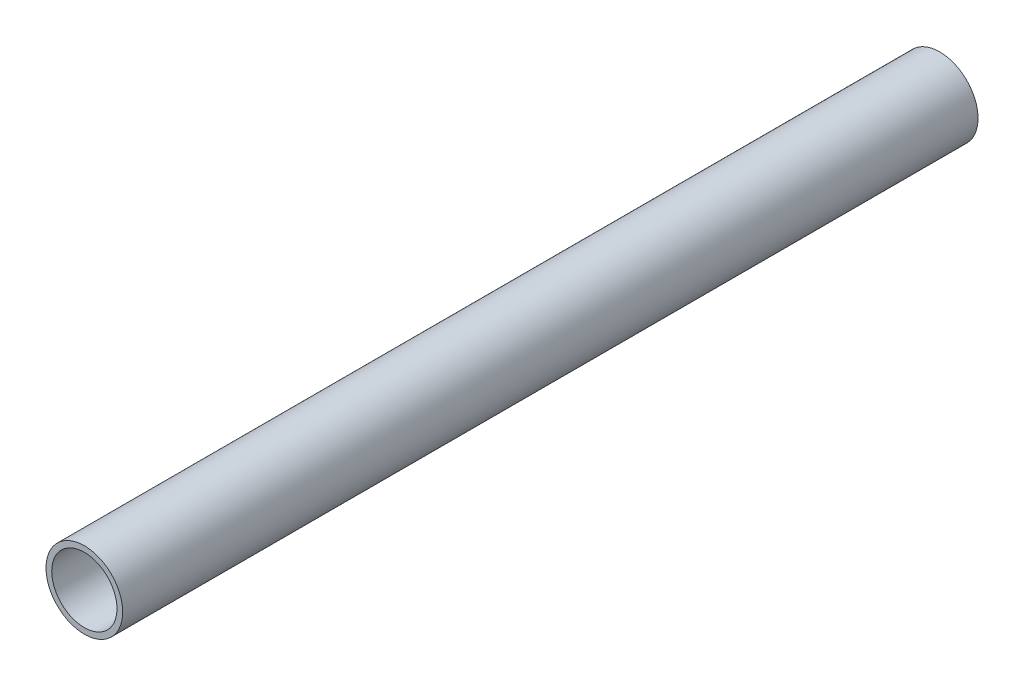
from build123d import *

# Parameters (mm, degrees)
SKETCH1_R           = 13.45
SKETCH1_R_2         = 11.45
EXTRUDE_THIN1_DEPTH = 150


with BuildPart() as part:
    # Sketch1 → Extrude-Thin1 (new, symmetric)
    with BuildSketch(Plane.XY):
        Circle(SKETCH1_R)
        Circle(SKETCH1_R_2, mode=Mode.SUBTRACT)
    extrude(amount=EXTRUDE_THIN1_DEPTH, both=True)


solid = part.part
